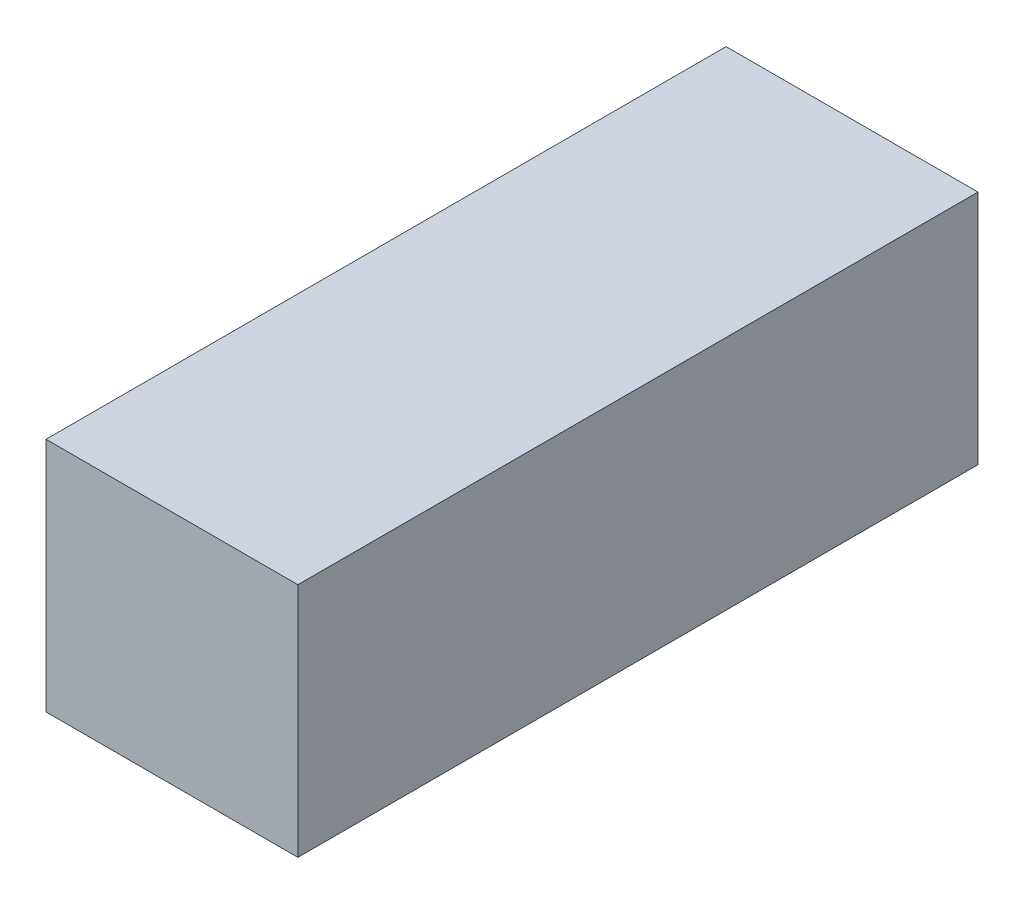
from build123d import *

# Parameters (mm, degrees)
SKETCH1_W           = 26.666666504
SKETCH1_H           = 25
BOSS_EXTRUDE1_DEPTH = 72


with BuildPart() as part:
    # Sketch1 → Boss-Extrude1 (new body)
    with BuildSketch(Plane.XY):
        with Locations((-13.333333252, 12.5)):
            Rectangle(SKETCH1_W, SKETCH1_H)
    extrude(amount=BOSS_EXTRUDE1_DEPTH)


solid = part.part
